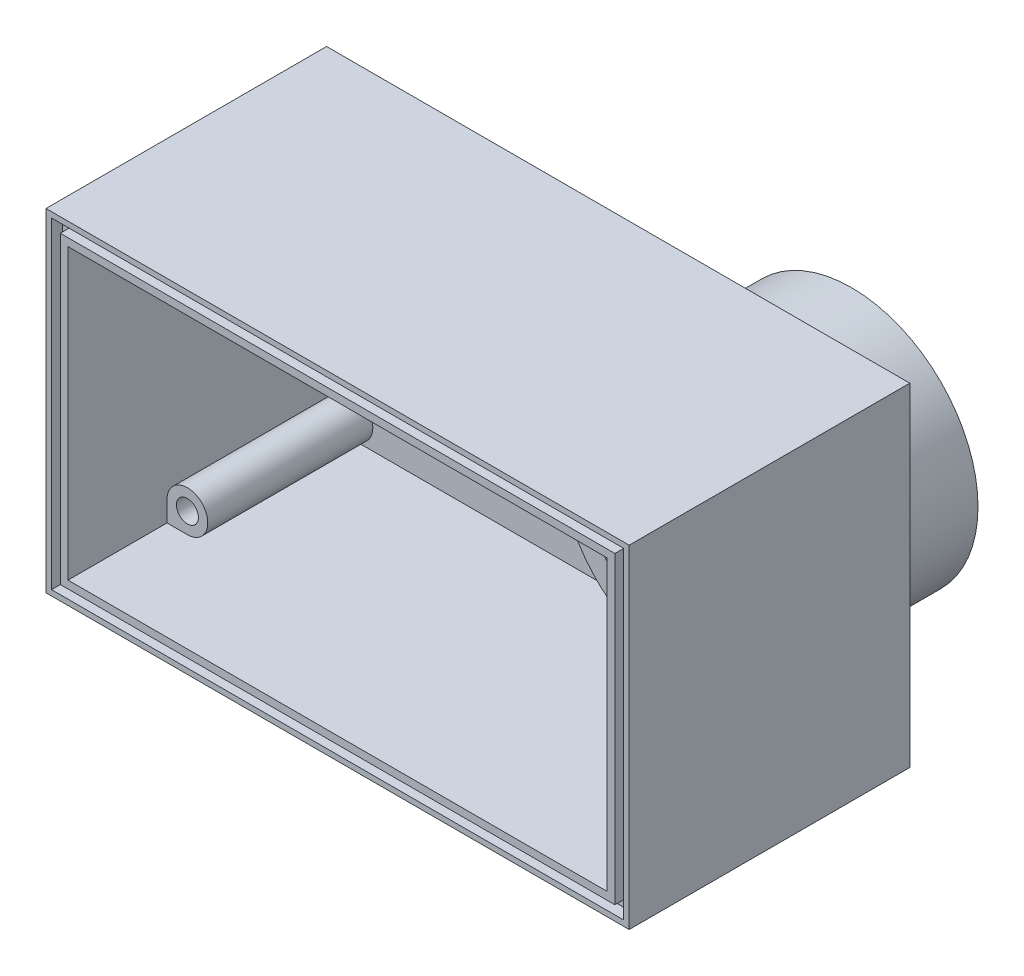
from build123d import *

# Parameters (mm, degrees)
SKETCH_1_W               = 53
SKETCH_1_H               = 30.25
EXTRUDE_1_DEPTH          = 32
SKETCH_2_W               = 49
SKETCH_2_H               = 26.25
CUT_EXTRUDE_1_DEPTH      = 24
SKETCH_3_W               = 52
SKETCH_3_H               = 29.25
SKETCH_3_W_2             = 50.4
SKETCH_3_H_2             = 27.65
CUT_EXTRUDE_2_DEPTH      = 1
EXTRUDE_2_DEPTH          = 15
SKETCH_7_R               = 1
CUT_EXTRUDE_4_DEPTH      = 10
MIRROR_2_COPY_1_DEPTH    = 15
MIRROR_2_COPY_2_SKETCH_R = 1
MIRROR_2_COPY_2_DEPTH    = 10
SKETCH_8_W               = 53
SKETCH_8_H               = 30.25
CUT_EXTRUDE_5_DEPTH      = 2
SKETCH_11_R              = 5
CUT_EXTRUDE_6_DEPTH      = 43.790368367
SKETCH_12_R              = 11.5
SKETCH_12_R_2            = 9.5
EXTRUDE_4_DEPTH          = 5
CUT_EXTRUDE_START        = -4.5
SKETCH_13_R              = 9.5
CUT_EXTRUDE_7_DEPTH      = 4.5
SKETCH_14_W              = 53
SKETCH_14_H              = 30.25
SKETCH_14_R              = 11.5
CUT_EXTRUDE_8_DEPTH      = 4.5
SKETCH_15_R              = 2
SKETCH_15_R_2            = 1
EXTRUDE_5_DEPTH          = 3
SKETCH_16_R              = 2
SKETCH_16_R_2            = 1
EXTRUDE_6_DEPTH          = 3
EXTRUDE_START            = 2
SKETCH_18_R              = 11.5
SKETCH_18_R_2            = 7
EXTRUDE_8_DEPTH          = 2
SKETCH_19_R              = 11.5
SKETCH_19_R_2            = 5
EXTRUDE_9_DEPTH          = 2


with BuildPart() as part:
    # 草图1 → 凸台-拉伸1 (new body)
    with BuildSketch(Plane.XY):
        Rectangle(SKETCH_1_W, SKETCH_1_H)
    extrude(amount=EXTRUDE_1_DEPTH)

    # 草图2 → 切除-拉伸1 (cut)
    with BuildSketch(Plane.XY.offset(32)):
        Rectangle(SKETCH_2_W, SKETCH_2_H)
    extrude(amount=-CUT_EXTRUDE_1_DEPTH, mode=Mode.SUBTRACT)

    # 草图3 → 切除-拉伸2 (cut)
    with BuildSketch(Plane.XY.offset(32)):
        Rectangle(SKETCH_3_W, SKETCH_3_H)
        Rectangle(SKETCH_3_W_2, SKETCH_3_H_2, mode=Mode.SUBTRACT)
    extrude(amount=-CUT_EXTRUDE_2_DEPTH, mode=Mode.SUBTRACT)

    # 草图6 → 凸台-拉伸2 (add)
    with BuildSketch(Plane.XY.offset(8)):
        with BuildLine():
            Line((-22.656269654, 13.125), (-24.5, 13.125))
            Line((-24.5, 13.125), (-24.5, 11.268730346))
            ThreePointArc((-24.5, 11.268730346), (-21.33741914, 9.97128577), (-22.656269654, 13.125))
        make_face()
    extrude_2 = extrude(amount=EXTRUDE_2_DEPTH)

    # 草图7 → 切除-拉伸4 (cut)
    with BuildSketch(Plane.XY.offset(23)):
        with Locations((-22.65, 11.275)):
            Circle(SKETCH_7_R)
    cut_extrude_4 = extrude(amount=-CUT_EXTRUDE_4_DEPTH, mode=Mode.SUBTRACT)

    # 镜向1: 凸台-拉伸2, 切除-拉伸4 across plane
    add(extrude_2.mirror(Plane.ZX))
    add(cut_extrude_4.mirror(Plane.ZX), mode=Mode.SUBTRACT)

    # 镜向2: 凸台-拉伸2, 切除-拉伸4 across plane
    add(extrude_2.mirror(Plane(origin=(0, 0, 0), x_dir=(0, 0, 1), z_dir=(1, 0, 0))))
    add(cut_extrude_4.mirror(Plane(origin=(0, 0, 0), x_dir=(0, 0, 1), z_dir=(1, 0, 0))), mode=Mode.SUBTRACT)

    # 镜向2 copy 1 sketch → 镜向2 copy 1 (add)
    with BuildSketch(Plane(origin=(0, 0, 8), x_dir=(-1, 0, 0), z_dir=(0, 0, 1))):
        with BuildLine():
            Line((-22.656269654, 13.125), (-24.5, 13.125))
            Line((-24.5, 13.125), (-24.5, 11.268730346))
            ThreePointArc((-24.5, 11.268730346), (-21.33741914, 9.97128577), (-22.656269654, 13.125))
        make_face()
    extrude(amount=MIRROR_2_COPY_1_DEPTH)

    # 镜向2 copy 2 sketch → 镜向2 copy 2 (cut)
    with BuildSketch(Plane(origin=(0, 0, 23), x_dir=(-1, 0, 0), z_dir=(0, 0, 1))):
        with Locations((-22.65, 11.275)):
            Circle(MIRROR_2_COPY_2_SKETCH_R)
    extrude(amount=-MIRROR_2_COPY_2_DEPTH, mode=Mode.SUBTRACT)

    # 草图8 → 切除-拉伸5 (cut)
    with BuildSketch(Plane(origin=(0, 0, 0), x_dir=(-1, 0, 0), z_dir=(0, 0, -1))):
        Rectangle(SKETCH_8_W, SKETCH_8_H)
    extrude(amount=-CUT_EXTRUDE_5_DEPTH, mode=Mode.SUBTRACT)

    # 草图11 → 切除-拉伸6 (cut, through all)
    with BuildSketch(Plane(origin=(0, 0, 2), x_dir=(-1, 0, 0), z_dir=(0, 0, -1))):
        with Locations((-12.7, 0)):
            Circle(SKETCH_11_R)
    extrude(amount=-CUT_EXTRUDE_6_DEPTH, mode=Mode.SUBTRACT)

    # 草图12 → 凸台-拉伸4 (add)
    with BuildSketch(Plane.XY.offset(8)):
        with Locations((12.7, 0)):
            Circle(SKETCH_12_R)
        with Locations((12.7, 0)):
            Circle(SKETCH_12_R_2, mode=Mode.SUBTRACT)
    extrude(amount=EXTRUDE_4_DEPTH)

    # 草图13 → 切除-拉伸7 (cut)
    with BuildSketch(Plane.XY.offset(8).offset(CUT_EXTRUDE_START)):
        with Locations((12.7, 0)):
            Circle(SKETCH_13_R)
    extrude(amount=CUT_EXTRUDE_7_DEPTH, mode=Mode.SUBTRACT)

    # 草图14 → 切除-拉伸8 (cut)
    with BuildSketch(Plane(origin=(0, 0, 2), x_dir=(-1, 0, 0), z_dir=(0, 0, -1))):
        Rectangle(SKETCH_14_W, SKETCH_14_H)
        with Locations(Location((-12.7, 0, 0), (0, 0, 180))):
            Circle(SKETCH_14_R, mode=Mode.SUBTRACT)
    extrude(amount=-CUT_EXTRUDE_8_DEPTH, mode=Mode.SUBTRACT)

    # 草图15 → 凸台-拉伸5 (add)
    with BuildSketch(Plane.XY.offset(8)):
        with Locations((-12.5, 0.005)):
            Circle(SKETCH_15_R)
        with Locations((-12.5, 0.005)):
            Circle(SKETCH_15_R_2, mode=Mode.SUBTRACT)
    extrude(amount=EXTRUDE_5_DEPTH)

    # 草图16 → 凸台-拉伸6 (add)
    with BuildSketch(Plane.XY.offset(8)):
        Circle(SKETCH_16_R)
        Circle(SKETCH_16_R_2, mode=Mode.SUBTRACT)
    extrude(amount=EXTRUDE_6_DEPTH)

    # 草图18 → 凸台-拉伸8 (add)
    with BuildSketch(Plane(origin=(0, 0, 2), x_dir=(-1, 0, 0), z_dir=(0, 0, -1)).offset(EXTRUDE_START)):
        with Locations(Location((-12.7, 0, 0), (0, 0, 7.591184195))):
            Circle(SKETCH_18_R)
        with Locations((-12.7, 0)):
            Circle(SKETCH_18_R_2, mode=Mode.SUBTRACT)
    extrude(amount=-EXTRUDE_8_DEPTH)

    # 草图19 → 凸台-拉伸9 (add)
    with BuildSketch(Plane(origin=(0, 0, 0), x_dir=(-1, 0, 0), z_dir=(0, 0, -1)).offset(EXTRUDE_START)):
        with Locations(Location((-12.7, 0, 0), (0, 0, 7.591184195))):
            Circle(SKETCH_19_R)
        with Locations((-12.7, 0)):
            Circle(SKETCH_19_R_2, mode=Mode.SUBTRACT)
    extrude(amount=-EXTRUDE_9_DEPTH)


solid = part.part
